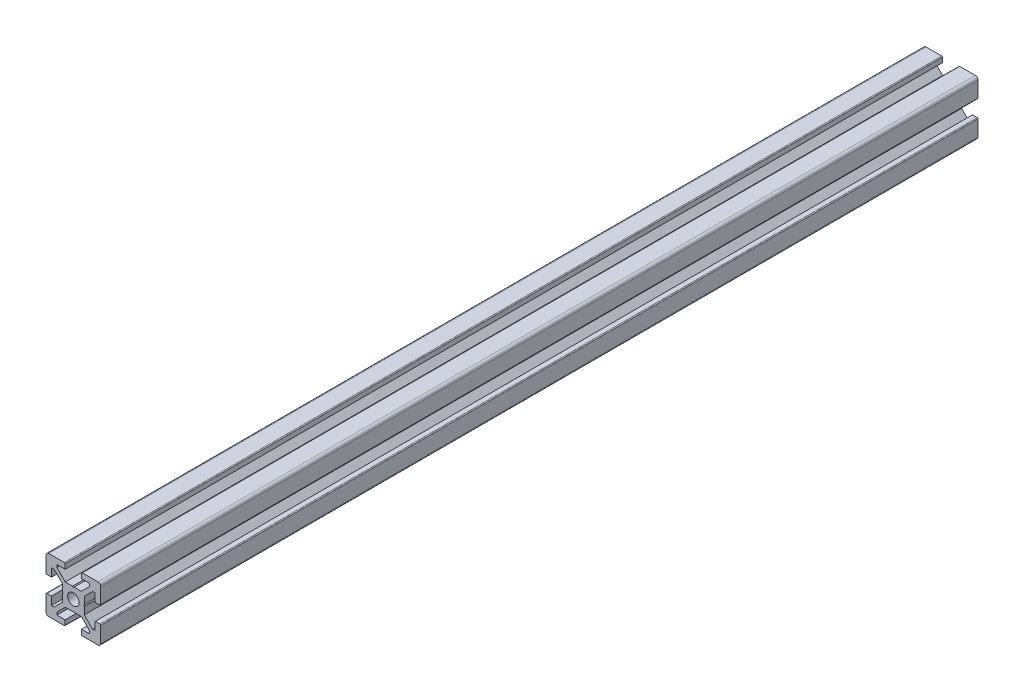
from build123d import *

# Parameters (mm, degrees)
SKETCH1_R           = 2.1
BOSS_EXTRUDE1_DEPTH = 160.45


with BuildPart() as part:
    # Sketch1 → Boss-Extrude1 (new, symmetric)
    with BuildSketch(Plane(origin=(0, 0, 0), x_dir=(-1, 0, 0), z_dir=(0, 0, -1))):
        with BuildLine():
            Line((10, 3.3), (10, 9))
            ThreePointArc((10, 9), (9.707106781, 9.707106781), (9, 10))
            Line((9, 10), (3.3, 10))
            ThreePointArc((3.3, 10), (3.087867966, 9.912132034), (3, 9.7))
            Line((3, 9.7), (3, 8))
            Line((3, 8), (6, 8))
            Line((6, 8), (6, 7.060660172))
            Line((6, 7.060660172), (2.939339828, 4))
            Line((2.939339828, 4), (0.3, 4))
            Line((0.3, 4), (0, 3.7))
            Line((0, 3.7), (-0.3, 4))
            Line((-0.3, 4), (-2.939339828, 4))
            Line((-2.939339828, 4), (-6, 7.060660172))
            Line((-6, 7.060660172), (-6, 8))
            Line((-6, 8), (-3, 8))
            Line((-3, 8), (-3, 9.7))
            ThreePointArc((-3, 9.7), (-3.087867966, 9.912132034), (-3.3, 10))
            Line((-3.3, 10), (-9, 10))
            ThreePointArc((-9, 10), (-9.707106781, 9.707106781), (-10, 9))
            Line((-10, 9), (-10, 3.3))
            ThreePointArc((-10, 3.3), (-9.912132034, 3.087867966), (-9.7, 3))
            Line((-9.7, 3), (-8, 3))
            Line((-8, 3), (-8, 6))
            Line((-8, 6), (-7.060660172, 6))
            Line((-7.060660172, 6), (-4, 2.939339828))
            Line((-4, 2.939339828), (-4, 0.3))
            Line((-4, 0.3), (-3.7, 0))
            Line((-3.7, 0), (-4, -0.3))
            Line((-4, -0.3), (-4, -2.939339828))
            Line((-4, -2.939339828), (-7.060660172, -6))
            Line((-7.060660172, -6), (-8, -6))
            Line((-8, -6), (-8, -3))
            Line((-8, -3), (-9.7, -3))
            ThreePointArc((-9.7, -3), (-9.912132034, -3.087867966), (-10, -3.3))
            Line((-10, -3.3), (-10, -9))
            ThreePointArc((-10, -9), (-9.707106781, -9.707106781), (-9, -10))
            Line((-9, -10), (-3.3, -10))
            ThreePointArc((-3.3, -10), (-3.087867966, -9.912132034), (-3, -9.7))
            Line((-3, -9.7), (-3, -8))
            Line((-3, -8), (-6, -8))
            Line((-6, -8), (-6, -7.060660172))
            Line((-6, -7.060660172), (-2.939339828, -4))
            Line((-2.939339828, -4), (-0.3, -4))
            Line((-0.3, -4), (0, -3.7))
            Line((0, -3.7), (0.3, -4))
            Line((0.3, -4), (2.939339828, -4))
            Line((2.939339828, -4), (6, -7.060660172))
            Line((6, -7.060660172), (6, -8))
            Line((6, -8), (3, -8))
            Line((3, -8), (3, -9.7))
            ThreePointArc((3, -9.7), (3.087867966, -9.912132034), (3.3, -10))
            Line((3.3, -10), (9, -10))
            ThreePointArc((9, -10), (9.707106781, -9.707106781), (10, -9))
            Line((10, -9), (10, -3.3))
            ThreePointArc((10, -3.3), (9.912132034, -3.087867966), (9.7, -3))
            Line((9.7, -3), (8, -3))
            Line((8, -3), (8, -6))
            Line((8, -6), (7.060660172, -6))
            Line((7.060660172, -6), (4, -2.939339828))
            Line((4, -2.939339828), (4, -0.3))
            Line((4, -0.3), (3.7, 0))
            Line((3.7, 0), (4, 0.3))
            Line((4, 0.3), (4, 2.939339828))
            Line((4, 2.939339828), (7.060660172, 6))
            Line((7.060660172, 6), (8, 6))
            Line((8, 6), (8, 3))
            Line((8, 3), (9.7, 3))
            ThreePointArc((9.7, 3), (9.912132034, 3.087867966), (10, 3.3))
        make_face()
        Circle(SKETCH1_R, mode=Mode.SUBTRACT)
    extrude(amount=BOSS_EXTRUDE1_DEPTH, both=True)


solid = part.part
